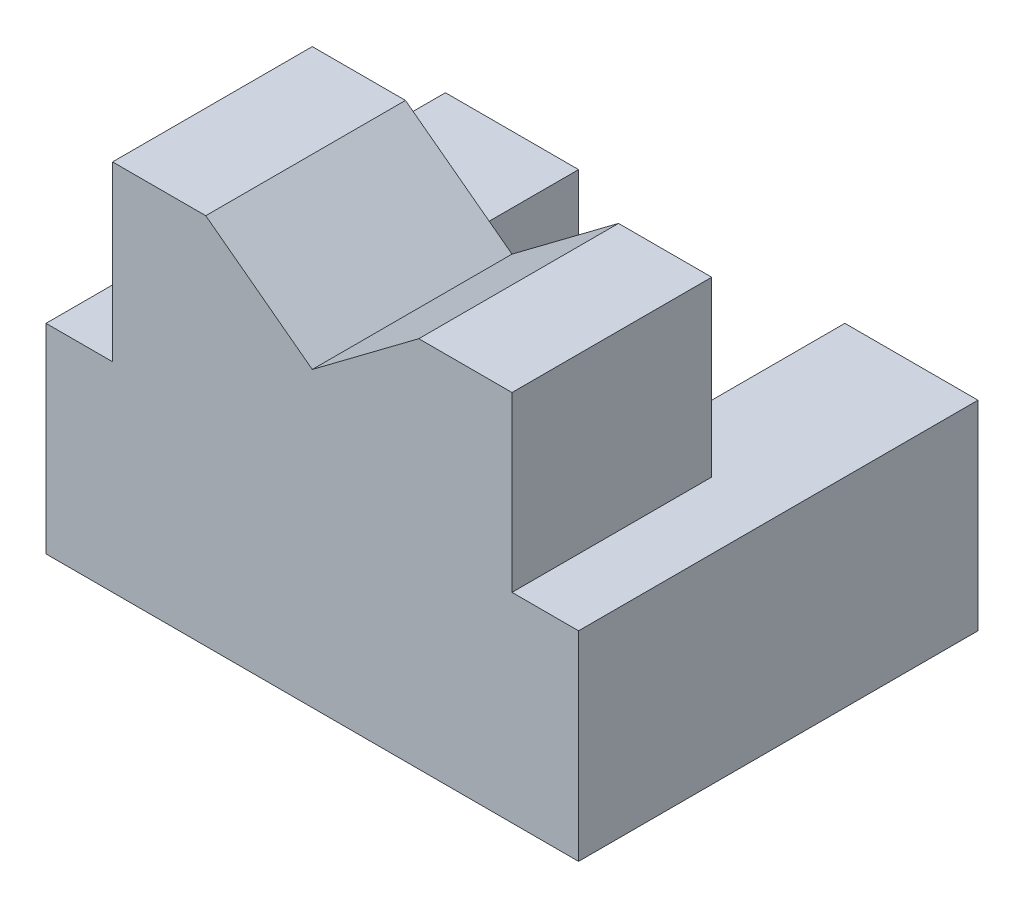
from build123d import *

# Parameters (mm, degrees)
SKETCH1_W           = 30
SKETCH1_H           = 28
BOSS_EXTRUDE1_DEPTH = 15
CUT_EXTRUDE4_DEPTH  = 44.69210455
SKETCH3_W           = 5
SKETCH3_H           = 15
EXTRUDE_3_DEPTH     = 30


with BuildPart() as part:
    # Sketch1 → Boss-Extrude1 (new body)
    with BuildSketch(Plane.XY):
        with Locations((15, -14)):
            Rectangle(SKETCH1_W, SKETCH1_H)
    extrude(amount=-BOSS_EXTRUDE1_DEPTH)

    # Sketch2 → Cut-Extrude4 (cut, through all)
    with BuildSketch(Plane.XY):
        Polygon((23, 0), (15, -6), (7, 0), align=None)
    extrude(amount=-CUT_EXTRUDE4_DEPTH, mode=Mode.SUBTRACT)

    # Sketch3 → 凸台-拉伸3 (add)
    with BuildSketch(Plane.XY):
        with Locations((-2.5, -20.5)):
            Rectangle(SKETCH3_W, SKETCH3_H)
        with Locations((2.5, -20.5)):
            Rectangle(SKETCH3_W, SKETCH3_H)
        with Locations((27.5, -20.5)):
            Rectangle(SKETCH3_W, SKETCH3_H)
        with Locations((32.5, -20.5)):
            Rectangle(SKETCH3_W, SKETCH3_H)
    extrude(amount=-EXTRUDE_3_DEPTH)


solid = part.part
